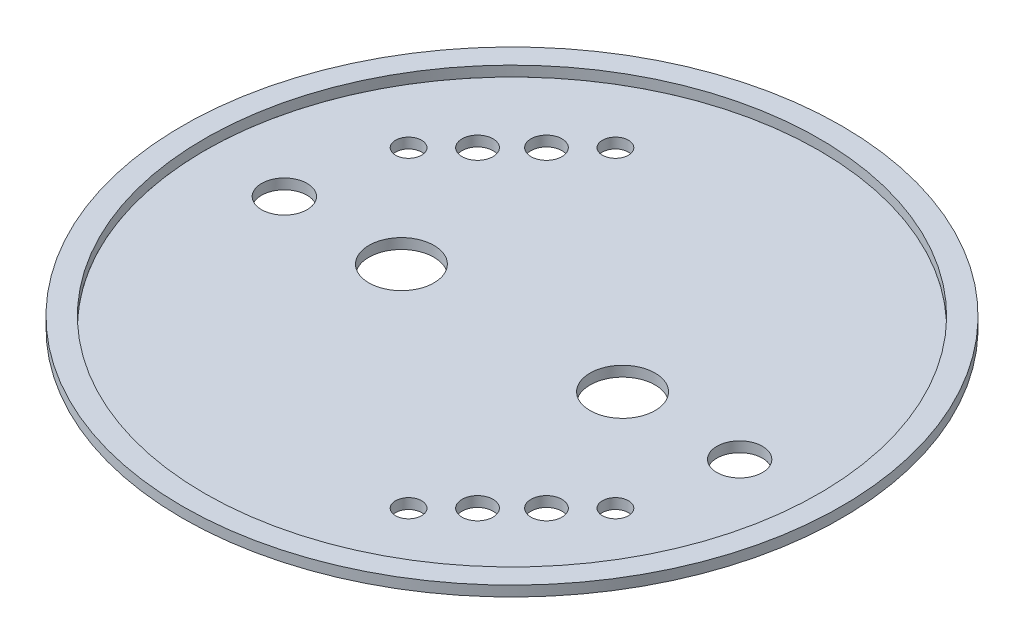
from build123d import *

# Parameters (mm, degrees)
SKETCH1_R           = 76
BOSS_EXTRUDE1_DEPTH = 15
SKETCH2_R           = 70.875
CUT_EXTRUDE1_DEPTH  = 7.5
CUT_EXTRUDE2_START  = -7.5
SKETCH3_R           = 74.25
SKETCH3_R_2         = 70.875
CUT_EXTRUDE2_DEPTH  = 7.5
SKETCH4_R           = 7.5
SKETCH4_R_2         = 5.25
SKETCH4_R_3         = 3.57
SKETCH4_R_4         = 3
CUT_EXTRUDE3_DEPTH  = 7.5
SKETCH10_R          = 76
SKETCH10_R_2        = 74.035858408
CUT_EXTRUDE6_DEPTH  = 7.5
SKETCH12_R          = 76
CUT_EXTRUDE8_DEPTH  = 5.12
SKETCH13_R          = 70.875
CUT_EXTRUDE9_DEPTH  = 5.12


with BuildPart() as part:
    # Sketch1 → Boss-Extrude1 (new body)
    with BuildSketch(Plane(origin=(0, 0, 0), x_dir=(1, 0, 0), z_dir=(0, 1, 0))):
        with Locations(Location((0, 0, 0), (0, 0, 270))):
            Circle(SKETCH1_R)
    extrude(amount=BOSS_EXTRUDE1_DEPTH)

    # Sketch2 → Cut-Extrude1 (cut)
    with BuildSketch(Plane(origin=(0, 15, 0), x_dir=(1, 0, 0), z_dir=(0, 1, 0))):
        with Locations(Location((0, 0, 0), (0, 0, 270))):
            Circle(SKETCH2_R)
    extrude(amount=-CUT_EXTRUDE1_DEPTH, mode=Mode.SUBTRACT)

    # Sketch3 → Cut-Extrude2 (cut)
    with BuildSketch(Plane(origin=(0, 0, 0), x_dir=(-1, 0, 0), z_dir=(0, -1, 0)).offset(CUT_EXTRUDE2_START)):
        with Locations(Location((0, 0, 0), (0, 0, 90))):
            Circle(SKETCH3_R)
        with Locations(Location((0, 0, 0), (0, 0, 270))):
            Circle(SKETCH3_R_2, mode=Mode.SUBTRACT)
    extrude(amount=CUT_EXTRUDE2_DEPTH, mode=Mode.SUBTRACT)


with BuildPart() as cut_extrude2_piece_1:
    # of the separate pieces the step leaves, piece 1, a body of its own (cut_extrude2_pieces)
    add(part.part.solids().sort_by_distance((0, 0, 70.875))[0])

    # Sketch4 → Cut-Extrude3 (cut)
    with BuildSketch(Plane(origin=(0, 7.5, 0), x_dir=(1, 0, 0), z_dir=(0, 1, 0))):
        with Locations(Location((-25.5, 0, 0), (0, 0, 270))):
            Circle(SKETCH4_R)
        with Locations(Location((-52.5, 0, 0), (0, 0, 270))):
            Circle(SKETCH4_R_2)
        with Locations(Location((25.5, 0, 0), (0, 0, 270))):
            Circle(SKETCH4_R)
        with Locations(Location((52.5, 0, 0), (0, 0, 270))):
            Circle(SKETCH4_R_2)
        with Locations(Location((-32.025, 39.975, 0), (0, 0, 270))):
            Circle(SKETCH4_R_3)
        with Locations(Location((-39.975, 32.025, 0), (0, 0, 270))):
            Circle(SKETCH4_R_3)
        with Locations(Location((-47.925, 24.075, 0), (0, 0, 270))):
            Circle(SKETCH4_R_4)
        with Locations(Location((-24.075, 47.925, 0), (0, 0, 270))):
            Circle(SKETCH4_R_4)
        with Locations(Location((32.025, -39.975, 0), (0, 0, 270))):
            Circle(SKETCH4_R_3)
        with Locations(Location((39.975, -32.025, 0), (0, 0, 270))):
            Circle(SKETCH4_R_3)
        with Locations(Location((47.925, -24.075, 0), (0, 0, 270))):
            Circle(SKETCH4_R_4)
        with Locations(Location((24.075, -47.925, 0), (0, 0, 270))):
            Circle(SKETCH4_R_4)
    extrude(amount=-CUT_EXTRUDE3_DEPTH, mode=Mode.SUBTRACT)

    # Sketch13 → Cut-Extrude9 (cut)
    with BuildSketch(Plane.XZ):
        with Locations(Location((0, 0, 0), (0, 0, 90))):
            Circle(SKETCH13_R)
    extrude(amount=-CUT_EXTRUDE9_DEPTH, mode=Mode.SUBTRACT)


with BuildPart() as cut_extrude2_piece_2:
    # of the separate pieces the step leaves, piece 2, a body of its own (cut_extrude2_pieces)
    add(part.part.solids().sort_by_distance((0, 0, 76))[0])

    # Sketch10 → Cut-Extrude6 (cut)
    with BuildSketch(Plane.XZ):
        with Locations(Location((0, 0, 0), (0, 0, 270))):
            Circle(SKETCH10_R)
        Circle(SKETCH10_R_2, mode=Mode.SUBTRACT)
    extrude(amount=-CUT_EXTRUDE6_DEPTH, mode=Mode.SUBTRACT)

    # Sketch12 → Cut-Extrude8 (cut)
    with BuildSketch(Plane(origin=(0, 15, 0), x_dir=(1, 0, 0), z_dir=(0, 1, 0))):
        with Locations(Location((0, 0, 0), (0, 0, 90))):
            Circle(SKETCH12_R)
    extrude(amount=-CUT_EXTRUDE8_DEPTH, mode=Mode.SUBTRACT)


solid = Compound([cut_extrude2_piece_1.part, cut_extrude2_piece_2.part])
